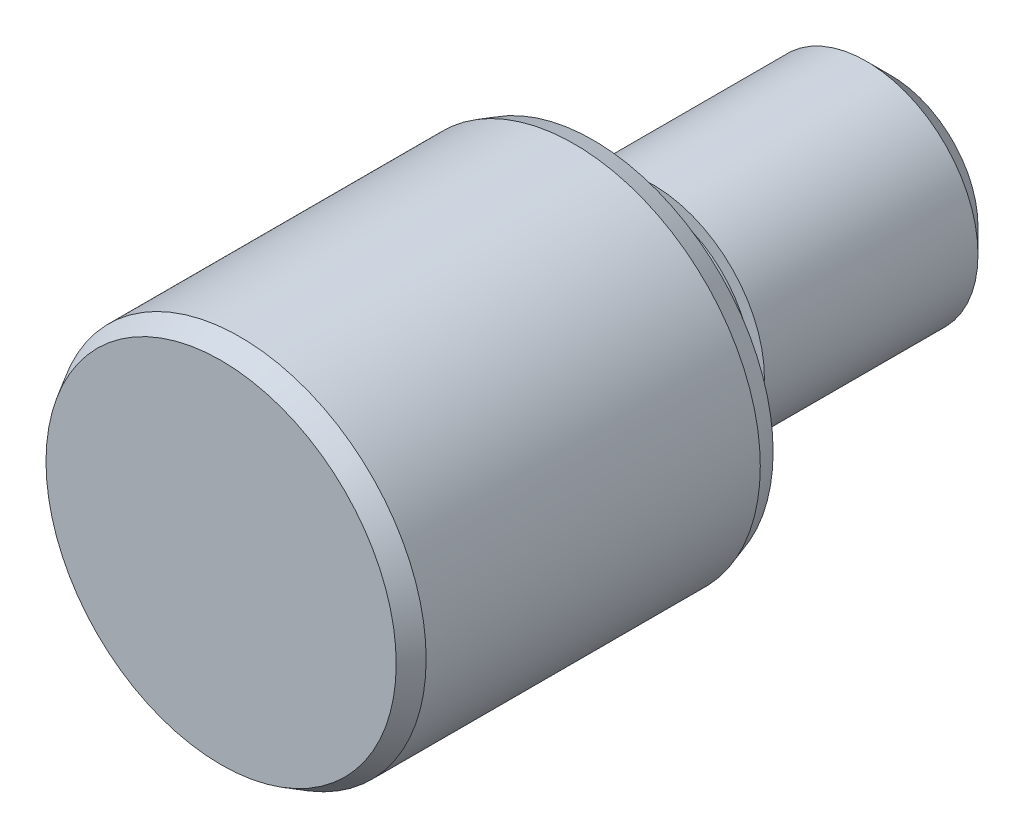
from build123d import *

# Parameters (mm, degrees)
CHAMFER1_SIZE  = 0.809625
CHAMFER1_SIZE2 = 0.467437212
CHAMFER2_SIZE  = 1.04775
FILLET1_R      = 0.1905
CHAMFER4_SIZE  = 0.809625
CHAMFER4_SIZE2 = 0.263063109


with BuildPart() as part:
    # Sketch2 → Revolve2 (revolve)
    with BuildSketch(Plane(origin=(0, 0, 0), x_dir=(0, 0, -1), z_dir=(1, 0, 0)), mode=Mode.PRIVATE) as revolve2_sk:
        Polygon((4.1275, 4.7625), (4.1275, 4.2148125), (3.5798125, 4.2148125), (1.5875, 4.2148125), (1.5875, 7.9375), (-14.2875, 7.9375), (-14.2875, 0), (14.2875, 0), (14.2875, 4.7625), align=None)
    revolve(revolve2_sk.sketch.rotate(Axis((0, 0, 14.2875), (0, 0, -1)), 90), axis=Axis((0, 0, 14.2875), (0, 0, -1)))

    # Chamfer1
    chamfer1_edges = [part.edges().sort_by_distance(p)[0] for p in [
        (-7.9375, 0, 14.2875),
    ]]
    chamfer1_side = [part.faces().sort_by_distance(p)[0] for p in [
        (-7.9375, 0, 6.35),
    ]]
    chamfer(chamfer1_edges, length=CHAMFER1_SIZE, length2=CHAMFER1_SIZE2, reference=chamfer1_side[0])

    # Chamfer2
    chamfer2_edges = [part.edges().sort_by_distance(p)[0] for p in [
        (-4.7625, 0, -14.2875),
    ]]
    chamfer(chamfer2_edges, length=CHAMFER2_SIZE)

    # Fillet1
    fillet1_edges = [part.edges().sort_by_distance(p)[0] for p in [
        (-4.2148125, 0, -1.5875),
    ]]
    fillet(fillet1_edges, radius=FILLET1_R)

    # Chamfer4
    chamfer4_edges = [part.edges().sort_by_distance(p)[0] for p in [
        (-7.9375, 0, -1.5875),
    ]]
    chamfer4_side = [part.faces().sort_by_distance(p)[0] for p in [
        (-7.9375, 0, 5.9451875),
    ]]
    chamfer(chamfer4_edges, length=CHAMFER4_SIZE, length2=CHAMFER4_SIZE2, reference=chamfer4_side[0])


solid = part.part
